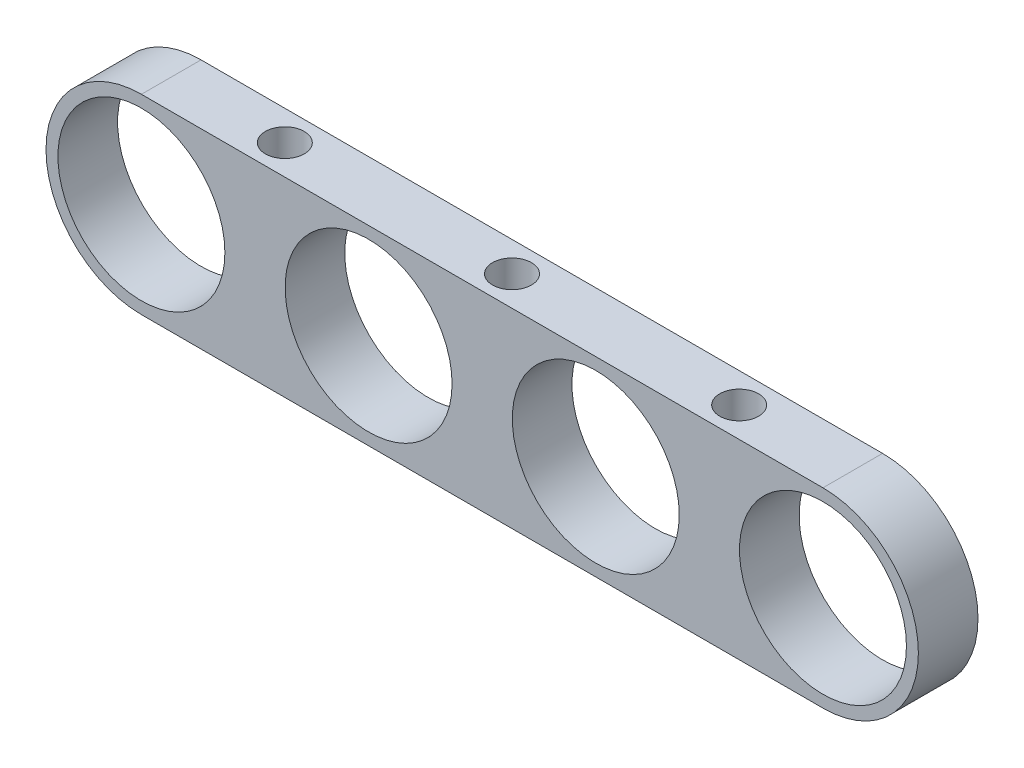
from build123d import *

# Parameters (mm, degrees)
SKETCH1_R           = 14
BOSS_EXTRUDE1_DEPTH = 10
SKETCH3_R           = 3.263423297
CUT_EXTRUDE1_DEPTH  = 10
SKETCH4_R           = 1.5875
CUT_EXTRUDE2_DEPTH  = 133.522035903
LPATTERN1_COUNT     = 3
LPATTERN1_PITCH     = 38.1


with BuildPart() as part:
    # Sketch1 → Boss-Extrude1 (new body)
    with BuildSketch(Plane.XY):
        with BuildLine():
            Line((0, 16), (114.3, 16))
            ThreePointArc((114.3, 16), (130.3, 0), (114.3, -16))
            Line((114.3, -16), (0, -16))
            ThreePointArc((0, -16), (-16, 0), (0, 16))
        make_face()
        Circle(SKETCH1_R, mode=Mode.SUBTRACT)
        with Locations((38.1, 0)):
            Circle(SKETCH1_R, mode=Mode.SUBTRACT)
        with Locations((76.2, 0)):
            Circle(SKETCH1_R, mode=Mode.SUBTRACT)
        with Locations((114.3, 0)):
            Circle(SKETCH1_R, mode=Mode.SUBTRACT)
    extrude(amount=BOSS_EXTRUDE1_DEPTH)

    # Sketch3 → Cut-Extrude1 (cut)
    with BuildSketch(Plane(origin=(0, 16, 0), x_dir=(1, 0, 0), z_dir=(0, 1, 0))):
        with Locations(Location((19.05, -5, 0), (0, 0, 270))):
            Circle(SKETCH3_R)
    cut_extrude1 = extrude(amount=-CUT_EXTRUDE1_DEPTH, mode=Mode.SUBTRACT)

    # Sketch4 → Cut-Extrude2 (cut, through all)
    with BuildSketch(Plane(origin=(0, 6, 0), x_dir=(1, 0, 0), z_dir=(0, 1, 0))):
        with Locations(Location((19.05, -5, 0), (0, 0, 270))):
            Circle(SKETCH4_R)
    cut_extrude2 = extrude(amount=-CUT_EXTRUDE2_DEPTH, mode=Mode.SUBTRACT)

    # LPattern1: Cut-Extrude1, Cut-Extrude2 ×3
    with Locations(*[(i * LPATTERN1_PITCH, 0, 0) for i in range(1, LPATTERN1_COUNT)]):
        add(cut_extrude1, mode=Mode.SUBTRACT)
        add(cut_extrude2, mode=Mode.SUBTRACT)


solid = part.part
